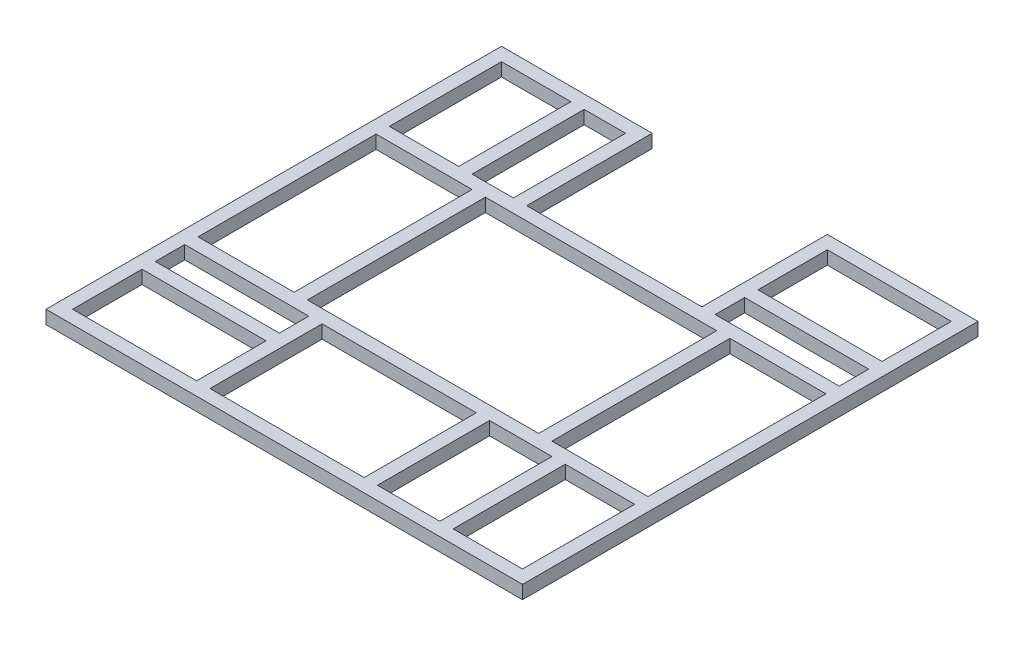
from build123d import *

# Parameters (mm, degrees)
SKETCH1_W           = 177
SKETCH1_H           = 99
SKETCH1_H_2         = 42
SKETCH1_W_2         = 220
SKETCH1_H_3         = 160
SKETCH1_W_3         = 89
SKETCH1_W_4         = 99
SKETCH1_W_5         = 137
SKETCH1_H_4         = 254
SKETCH1_W_6         = 59
BOSS_EXTRUDE1_DEPTH = 19


with BuildPart() as part:
    # Sketch1 → Boss-Extrude1 (new body)
    with BuildSketch(Plane(origin=(0, 0, 0), x_dir=(1, 0, 0), z_dir=(0, 1, 0))):
        Polygon((-340, 325), (-340, -325), (340, -325), (340, 325), (125, 325), (125, 146), (-125, 146), (-125, 325), align=None)
        with Locations((-232.5, -256.5)):
            Rectangle(SKETCH1_W, SKETCH1_H, mode=Mode.SUBTRACT)
        with Locations((-232.5, -167)):
            Rectangle(SKETCH1_W, SKETCH1_H_2, mode=Mode.SUBTRACT)
        with Locations((-15, -226)):
            Rectangle(SKETCH1_W_2, SKETCH1_H_3, mode=Mode.SUBTRACT)
        with Locations((158.5, -226)):
            Rectangle(SKETCH1_W_3, SKETCH1_H_3, mode=Mode.SUBTRACT)
        with Locations((271.5, -226)):
            Rectangle(SKETCH1_W_4, SKETCH1_H_3, mode=Mode.SUBTRACT)
        with Locations((-252.5, 0)):
            Rectangle(SKETCH1_W_5, SKETCH1_H_4, mode=Mode.SUBTRACT)
        with Locations((-271.5, 226)):
            Rectangle(SKETCH1_W_4, SKETCH1_H_3, mode=Mode.SUBTRACT)
        with Locations((-173.5, 226)):
            Rectangle(SKETCH1_W_6, SKETCH1_H_3, mode=Mode.SUBTRACT)
        Polygon((-165, -127), (-165, 127), (132.861538462, 127), (165, 127), (165, -127), (114, -127), (95, -127), (-125, -127), (-144, -127), align=None, mode=Mode.SUBTRACT)
        with Locations((252.5, 0)):
            Rectangle(SKETCH1_W_5, SKETCH1_H_4, mode=Mode.SUBTRACT)
        with Locations((232.5, 167)):
            Rectangle(SKETCH1_W, SKETCH1_H_2, mode=Mode.SUBTRACT)
        with Locations((232.5, 256.5)):
            Rectangle(SKETCH1_W, SKETCH1_H, mode=Mode.SUBTRACT)
    extrude(amount=BOSS_EXTRUDE1_DEPTH)


solid = part.part
